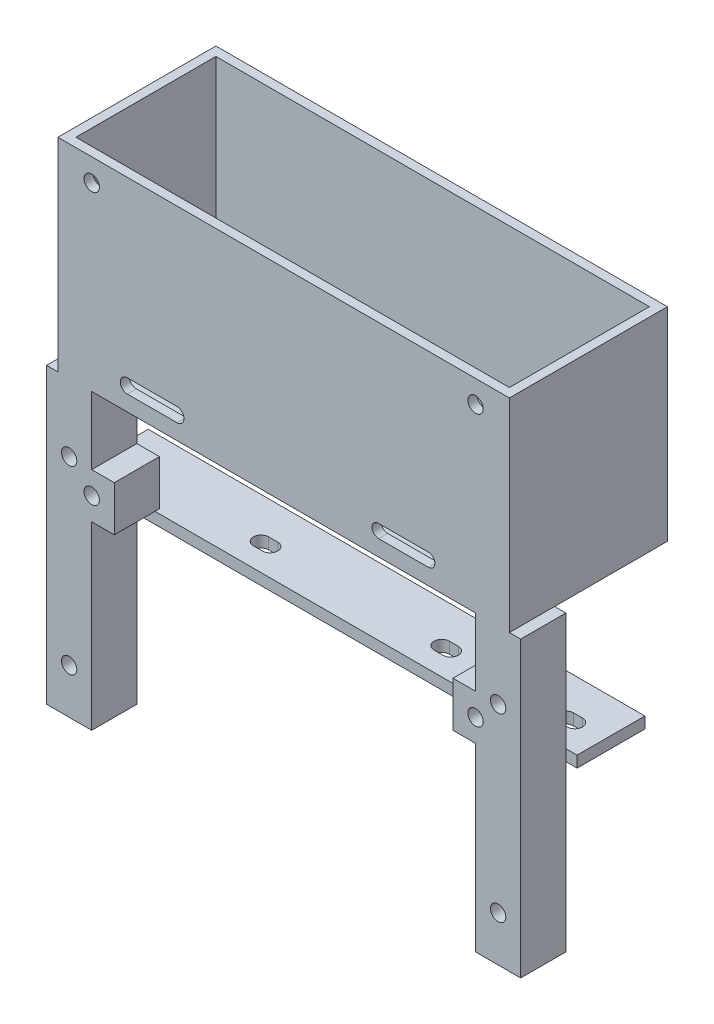
from build123d import *

# Parameters (mm, degrees)
V3_BOX_FOOTPRINT_100_X_45_MM_W                 = 100
V3_BOX_FOOTPRINT_100_X_45_MM_H                 = 45
V3_BOX_HEIGHT_35_MM_DEPTH                      = 35
V3_REAR_OPENING_96_X_31_MM_W                   = 96
V3_REAR_OPENING_96_X_31_MM_H                   = 31
V3_CAVITY_ALL_WALLS_2_MM_DEPTH                 = 43
V3_SQUARE_BEAMS_10_X_10_PITCH_95_MM_W          = 10
V3_SQUARE_BEAMS_10_X_10_PITCH_95_MM_H          = 10
V3_FORWARD_BEAM_LENGTH_65_MM_DEPTH             = 65
V3_LEFT_PCB_EAR_PROFILE_W                      = 10
V3_LEFT_PCB_EAR_PROFILE_H                      = 10
V3_LEFT_INWARD_EAR_5_MM_DEPTH                  = 5
V3_RIGHT_PCB_EAR_PROFILE_W                     = 10
V3_RIGHT_PCB_EAR_PROFILE_H                     = 10
V3_RIGHT_INWARD_EAR_5_MM_DEPTH                 = 5
V3_PCB_ROOF_PAIR_PITCH_85_MM_R                 = 1.7
V3_M3_ROOF_HOLES_DIAMETER_3_4_MM_DEPTH         = 2
V3_PCB_FORWARD_PAIR_ROW_SPACING_60_MM_R        = 1.7
V3_M3_PCB_EAR_HOLES_DEPTH                      = 10
V3_CHASSIS_TOP_HOLES_WIDTH_95_DEPTH_40_M_R     = 1.7
V3_M3_BEAM_TOP_BOTTOM_HOLES_DEPTH              = 10
V3_HANGING_PLATE_OFFSET_26_THICKNESS_2_5_W     = 110
V3_HANGING_PLATE_OFFSET_26_THICKNESS_2_5_H     = 2.5
V3_MOUNTING_PLATE_DOWNWARD_15_MM_WIDTH_1_DEPTH = 15
FOUR_HORIZONTAL_SLOTS_3_4_X_5_4_MM_DEPTH       = 2.5
CUT_EXTRUDE_1_DEPTH                            = 93.059763198


with BuildPart() as part:
    # V3 box footprint 100 x 45 mm → V3 box height 35 mm (new body)
    with BuildSketch(Plane.XY):
        with Locations((0, 22.5)):
            Rectangle(V3_BOX_FOOTPRINT_100_X_45_MM_W, V3_BOX_FOOTPRINT_100_X_45_MM_H)
    extrude(amount=V3_BOX_HEIGHT_35_MM_DEPTH)

    # V3 rear opening 96 x 31 mm → V3 cavity all walls 2 mm (cut)
    with BuildSketch(Plane(origin=(0, 45, 0), x_dir=(1, 0, 0), z_dir=(0, 1, 0))):
        with Locations((0, -17.5)):
            Rectangle(V3_REAR_OPENING_96_X_31_MM_W, V3_REAR_OPENING_96_X_31_MM_H)
    extrude(amount=-V3_CAVITY_ALL_WALLS_2_MM_DEPTH, mode=Mode.SUBTRACT)

    # V3 square beams 10 x 10 pitch 95 mm → V3 forward beam length 65 mm (add)
    with BuildSketch(Plane.XZ):
        with Locations((-47.5, 30)):
            Rectangle(V3_SQUARE_BEAMS_10_X_10_PITCH_95_MM_W, V3_SQUARE_BEAMS_10_X_10_PITCH_95_MM_H)
        with Locations((47.5, 30)):
            Rectangle(V3_SQUARE_BEAMS_10_X_10_PITCH_95_MM_W, V3_SQUARE_BEAMS_10_X_10_PITCH_95_MM_H)
    extrude(amount=V3_FORWARD_BEAM_LENGTH_65_MM_DEPTH)

    # V3 left PCB ear profile → V3 left inward ear 5 mm (add)
    with BuildSketch(Plane(origin=(-42.5, 0, 0), x_dir=(0, 0, -1), z_dir=(1, 0, 0))):
        with Locations((-30, -20)):
            Rectangle(V3_LEFT_PCB_EAR_PROFILE_W, V3_LEFT_PCB_EAR_PROFILE_H)
    extrude(amount=V3_LEFT_INWARD_EAR_5_MM_DEPTH)

    # V3 right PCB ear profile → V3 right inward ear 5 mm (add)
    with BuildSketch(Plane.ZY.offset(-42.5)):
        with Locations((30, -20)):
            Rectangle(V3_RIGHT_PCB_EAR_PROFILE_W, V3_RIGHT_PCB_EAR_PROFILE_H)
    extrude(amount=V3_RIGHT_INWARD_EAR_5_MM_DEPTH)

    # V3 PCB roof pair pitch 85 mm → V3 M3 roof holes diameter 3.4 mm (cut)
    with BuildSketch(Plane.XY.offset(35)):
        with Locations((-42.5, 40)):
            Circle(V3_PCB_ROOF_PAIR_PITCH_85_MM_R)
        with Locations((42.5, 40)):
            Circle(V3_PCB_ROOF_PAIR_PITCH_85_MM_R)
    extrude(amount=-V3_M3_ROOF_HOLES_DIAMETER_3_4_MM_DEPTH, mode=Mode.SUBTRACT)

    # V3 PCB forward pair row spacing 60 mm → V3 M3 PCB ear holes (cut)
    with BuildSketch(Plane.XY.offset(35)):
        with Locations((-42.5, -20)):
            Circle(V3_PCB_FORWARD_PAIR_ROW_SPACING_60_MM_R)
        with Locations((42.5, -20)):
            Circle(V3_PCB_FORWARD_PAIR_ROW_SPACING_60_MM_R)
    extrude(amount=-V3_M3_PCB_EAR_HOLES_DEPTH, mode=Mode.SUBTRACT)

    # V3 chassis top holes width 95 depth 40 mm → V3 M3 beam top bottom holes (cut)
    with BuildSketch(Plane.XY.offset(35)):
        with Locations((-47.5, -55)):
            Circle(V3_CHASSIS_TOP_HOLES_WIDTH_95_DEPTH_40_M_R)
        with Locations((-47.5, -15)):
            Circle(V3_CHASSIS_TOP_HOLES_WIDTH_95_DEPTH_40_M_R)
        with Locations((47.5, -55)):
            Circle(V3_CHASSIS_TOP_HOLES_WIDTH_95_DEPTH_40_M_R)
        with Locations((47.5, -15)):
            Circle(V3_CHASSIS_TOP_HOLES_WIDTH_95_DEPTH_40_M_R)
    extrude(amount=-V3_M3_BEAM_TOP_BOTTOM_HOLES_DEPTH, mode=Mode.SUBTRACT)

    # V3 hanging plate offset 26 thickness 2.5 mm → V3 mounting plate downward 15 mm width 110 (add)
    with BuildSketch(Plane(origin=(0, 0, 25), x_dir=(-1, 0, 0), z_dir=(0, 0, -1))):
        with Locations((0, -27.25)):
            Rectangle(V3_HANGING_PLATE_OFFSET_26_THICKNESS_2_5_W, V3_HANGING_PLATE_OFFSET_26_THICKNESS_2_5_H)
    extrude(amount=V3_MOUNTING_PLATE_DOWNWARD_15_MM_WIDTH_1_DEPTH)

    # V3 slots 6 mm below beam underside centers 20 and 47.5 → Four horizontal slots 3.4 x 5.4 mm (cut)
    with BuildSketch(Plane.XZ.offset(28.5)):
        with BuildLine():
            Line((-48.5, 20.7), (-46.5, 20.7))
            ThreePointArc((-46.5, 20.7), (-44.8, 19), (-46.5, 17.3))
            Line((-46.5, 17.3), (-48.5, 17.3))
            ThreePointArc((-48.5, 17.3), (-50.2, 19), (-48.5, 20.7))
        make_face()
        with BuildLine():
            Line((-21, 20.7), (-19, 20.7))
            ThreePointArc((-19, 20.7), (-17.3, 19), (-19, 17.3))
            Line((-19, 17.3), (-21, 17.3))
            ThreePointArc((-21, 17.3), (-22.7, 19), (-21, 20.7))
        make_face()
        with BuildLine():
            Line((19, 20.7), (21, 20.7))
            ThreePointArc((21, 20.7), (22.7, 19), (21, 17.3))
            Line((21, 17.3), (19, 17.3))
            ThreePointArc((19, 17.3), (17.3, 19), (19, 20.7))
        make_face()
        with BuildLine():
            Line((46.5, 20.7), (48.5, 20.7))
            ThreePointArc((48.5, 20.7), (50.2, 19), (48.5, 17.3))
            Line((48.5, 17.3), (46.5, 17.3))
            ThreePointArc((46.5, 17.3), (44.8, 19), (46.5, 20.7))
        make_face()
    extrude(amount=-FOUR_HORIZONTAL_SLOTS_3_4_X_5_4_MM_DEPTH, mode=Mode.SUBTRACT)

    # 草图2 → 切除-拉伸1 (cut, through all)
    with BuildSketch(Plane(origin=(0, 0, 0), x_dir=(-1, 0, 0), z_dir=(0, 0, -1))):
        with BuildLine():
            Line((-32.029979042, 6.459471041), (-21.029979042, 6.459471041))
            ThreePointArc((-21.029979042, 6.459471041), (-19.570508001, 5), (-21.029979042, 3.540528959))
            Line((-21.029979042, 3.540528959), (-32.029979042, 3.540528959))
            ThreePointArc((-32.029979042, 3.540528959), (-33.489450083, 5), (-32.029979042, 6.459471041))
        make_face()
        with BuildLine():
            Line((23.620107008, 6.558669056), (34.620107008, 6.558669056))
            ThreePointArc((34.620107008, 6.558669056), (36.178776063, 5), (34.620107008, 3.441330944))
            Line((34.620107008, 3.441330944), (23.620107008, 3.441330944))
            ThreePointArc((23.620107008, 3.441330944), (22.061437952, 5), (23.620107008, 6.558669056))
        make_face()
    extrude(amount=-CUT_EXTRUDE_1_DEPTH, mode=Mode.SUBTRACT)


solid = part.part
